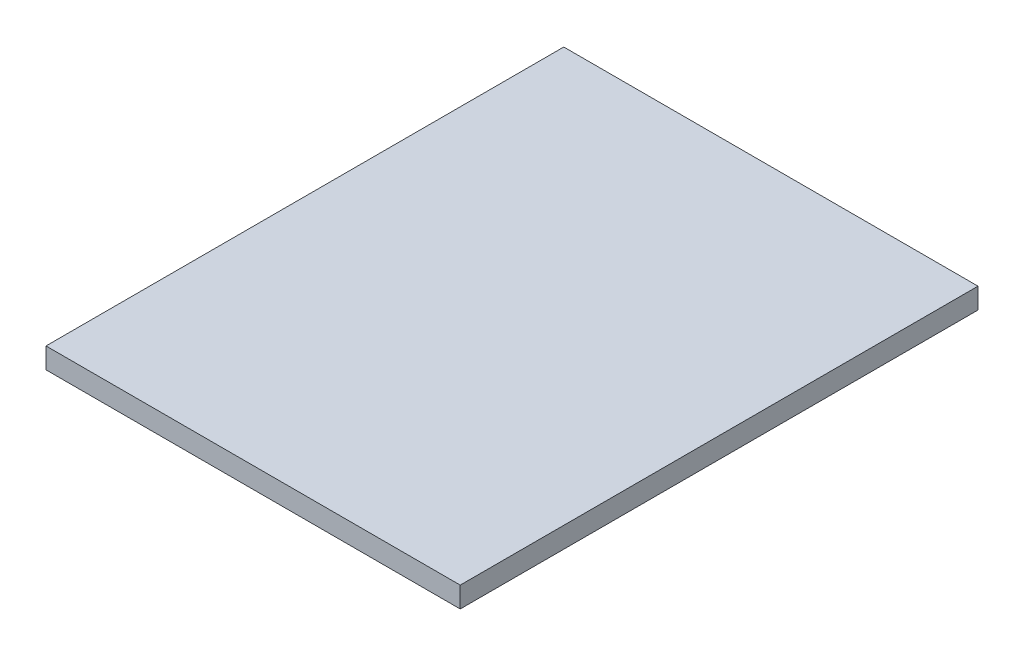
from build123d import *

# Parameters (mm, degrees)
SKETCH_1_W      = 200
SKETCH_1_H      = 10
EXTRUDE_1_DEPTH = 250


with BuildPart() as part:
    # Эскиз1 → Бобышка-Вытянуть1 (new body)
    with BuildSketch(Plane.XY):
        Rectangle(SKETCH_1_W, SKETCH_1_H)
    extrude(amount=EXTRUDE_1_DEPTH)


solid = part.part
